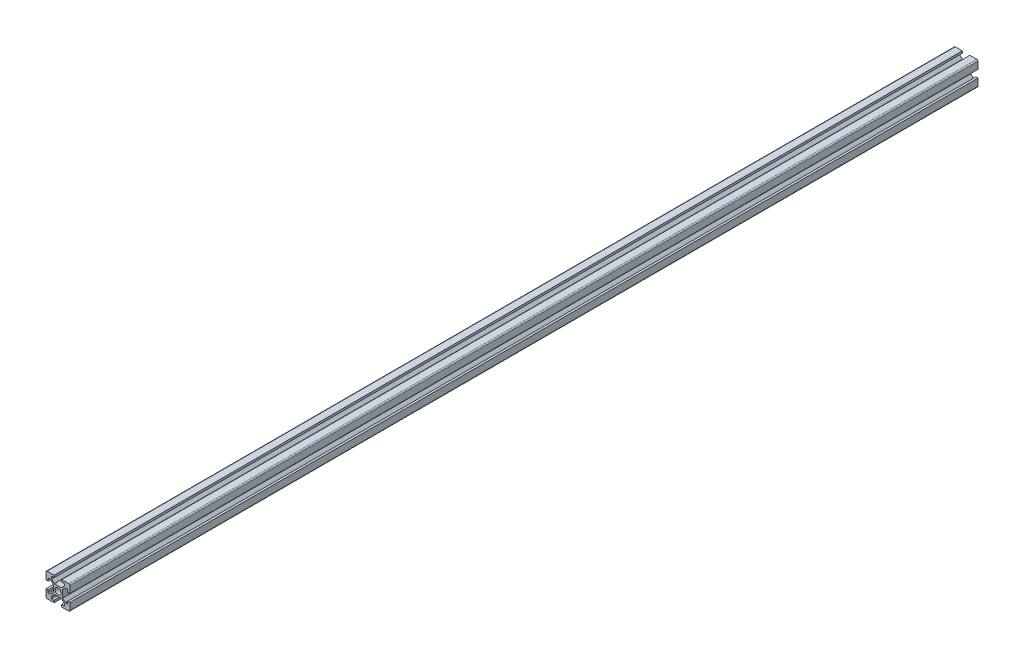
from build123d import *

# Parameters (mm, degrees)
SKETCH1_R           = 2.5
BOSS_EXTRUDE1_DEPTH = 762
FILLET1_R           = 1
FILLET2_R           = 0.5
FILLET3_R           = 0.5
FILLET4_R           = 0.5
FILLET5_R           = 0.5


with BuildPart() as part:
    # Sketch1 → Boss-Extrude1 (new body)
    with BuildSketch(Plane.XY):
        Polygon((13.2, 0), (13.2, 1.8), (15.45, 1.8), (15.45, 3.6), (12.95, 6.1), (7.05, 6.1), (4.55, 3.6), (4.55, 1.8), (6.8, 1.8), (6.8, 0), (0, 0), (0, 6.8), (1.8, 6.8), (1.8, 4.55), (3.6, 4.55), (6.1, 7.05), (6.1, 12.95), (3.6, 15.45), (1.8, 15.45), (1.8, 13.2), (0, 13.2), (0, 20), (6.8, 20), (6.8, 18.2), (4.55, 18.2), (4.55, 16.4), (7.05, 13.9), (12.95, 13.9), (15.45, 16.4), (15.45, 18.2), (13.2, 18.2), (13.2, 20), (20, 20), (20, 13.2), (18.2, 13.2), (18.2, 15.45), (16.4, 15.45), (13.9, 12.95), (13.9, 7.05), (16.4, 4.55), (18.2, 4.55), (18.2, 6.8), (20, 6.8), (20, 0), align=None)
        with Locations((10, 10)):
            Circle(SKETCH1_R, mode=Mode.SUBTRACT)
    extrude(amount=BOSS_EXTRUDE1_DEPTH)

    # Fillet1
    fillet1_edges = [part.edges().sort_by_distance(p)[0] for p in [
        (0, 0, 381),
        (0, 20, 381),
        (20, 20, 381),
        (20, 0, 381),
    ]]
    fillet(fillet1_edges, radius=FILLET1_R)

    # Fillet2
    fillet2_edges = [part.edges().sort_by_distance(p)[0] for p in [
        (4.55, 18.2, 381),
        (4.55, 16.4, 381),
        (7.05, 13.9, 381),
        (12.95, 13.9, 381),
        (15.45, 16.4, 381),
        (15.45, 18.2, 381),
    ]]
    fillet(fillet2_edges, radius=FILLET2_R)

    # Fillet3
    fillet3_edges = [part.edges().sort_by_distance(p)[0] for p in [
        (18.2, 15.45, 381),
        (16.4, 15.45, 381),
        (13.9, 12.95, 381),
        (13.9, 7.05, 381),
        (16.4, 4.55, 381),
        (18.2, 4.55, 381),
    ]]
    fillet(fillet3_edges, radius=FILLET3_R)

    # Fillet4
    fillet4_edges = [part.edges().sort_by_distance(p)[0] for p in [
        (1.8, 4.55, 381),
        (3.6, 4.55, 381),
        (6.1, 7.05, 381),
        (6.1, 12.95, 381),
        (3.6, 15.45, 381),
        (1.8, 15.45, 381),
    ]]
    fillet(fillet4_edges, radius=FILLET4_R)

    # Fillet5
    fillet5_edges = [part.edges().sort_by_distance(p)[0] for p in [
        (15.45, 1.8, 381),
        (15.45, 3.6, 381),
        (12.95, 6.1, 381),
        (7.05, 6.1, 381),
        (4.55, 3.6, 381),
        (4.55, 1.8, 381),
    ]]
    fillet(fillet5_edges, radius=FILLET5_R)


solid = part.part
